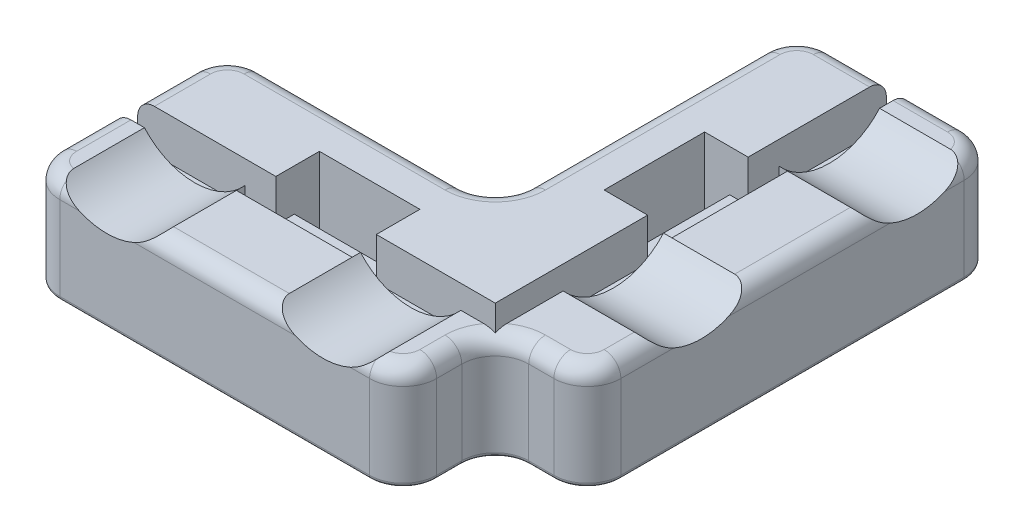
from build123d import *

# Parameters (mm, degrees)
EXTRUDE_677_DEPTH        = 12.5
SKETCH_6_R               = 1
CUT_EXTRUDE_1132_DEPTH   = 7
FILLET_1_R               = 2
CUT_EXTRUDE_1_DEPTH      = 84.019576005
CUT_EXTRUDE_1_DEPTH_BACK = 84.019576005
SKETCH_7_W               = 12
SKETCH_7_H               = 3
SKETCH_7_W_2             = 3
SKETCH_7_H_2             = 12
CUT_EXTRUDE_2_DEPTH      = 5
CUT_EXTRUDE_3_REACH      = 85.02
SKETCH_9_R               = 8
CUT_EXTRUDE_4_REACH      = 85.02
SKETCH_10_R              = 8
SKETCH_11_W              = 13.815009386
SKETCH_11_H              = 1
SKETCH_11_W_2            = 1
SKETCH_11_H_2            = 13.815009386
CUT_EXTRUDE_7_DEPTH      = 5
FILLET_2_R               = 0.5


with BuildPart() as part:
    # Эскиз1 → Extrude 677 (new body)
    with BuildSketch(Plane(origin=(0, 0, 0), x_dir=(1, 0, 0), z_dir=(0, 1, 0))):
        with BuildLine():
            Line((4, 0), (41, 0))
            ThreePointArc((41, 0), (43.828427125, 1.171572875), (45, 4))
            Line((45, 4), (45, 7))
            ThreePointArc((45, 7), (46.171572875, 9.828427125), (49, 11))
            Line((49, 11), (52, 11))
            ThreePointArc((52, 11), (54.828427125, 12.171572875), (56, 15))
            Line((56, 15), (56, 56))
            ThreePointArc((56, 56), (54.828427125, 58.828427125), (52, 60))
            Line((52, 60), (36, 60))
            ThreePointArc((36, 60), (33.171572875, 58.828427125), (32, 56))
            Line((32, 56), (32, 28))
            ThreePointArc((32, 28), (30.828427125, 25.171572875), (28, 24))
            Line((28, 24), (4, 24))
            ThreePointArc((4, 24), (1.171572875, 22.828427125), (0, 20))
            Line((0, 20), (0, 4))
            ThreePointArc((0, 4), (1.171572875, 1.171572875), (4, 0))
        make_face()
    extrude(amount=EXTRUDE_677_DEPTH)

    # Эскиз6 → Cut-Extrude 1132 (cut)
    with BuildSketch(Plane.XZ):
        with Locations(Location((4, -4, 0), (0, 0, 270))):
            Circle(SKETCH_6_R)
        with Locations(Location((41, -4, 0), (0, 0, 270))):
            Circle(SKETCH_6_R)
        with Locations(Location((52, -15, 0), (0, 0, 270))):
            Circle(SKETCH_6_R)
        with Locations(Location((4, -20, 0), (0, 0, 270))):
            Circle(SKETCH_6_R)
        with Locations(Location((36, -56, 0), (0, 0, 270))):
            Circle(SKETCH_6_R)
        with Locations(Location((52, -56, 0), (0, 0, 270))):
            Circle(SKETCH_6_R)
        with Locations(Location((34, -22, 0), (0, 0, 270))):
            Circle(SKETCH_6_R)
    extrude(amount=-CUT_EXTRUDE_1132_DEPTH, mode=Mode.SUBTRACT)

    # Скругление1
    fillet_1_edges = [part.edges().sort_by_distance(p)[0] for p in [
        (54.828427125, 12.5, -58.828427125),
        (44, 12.5, -60),
        (33.171572875, 12.5, -58.828427125),
        (32, 12.5, -42),
        (30.828427125, 12.5, -25.171572875),
        (16, 12.5, -24),
        (1.171572875, 12.5, -22.828427125),
        (0, 12.5, -12),
        (1.171572875, 12.5, -1.171572875),
        (22.5, 12.5, 0),
        (54.828427125, 12.5, -12.171572875),
        (43.828427125, 12.5, -1.171572875),
        (45, 12.5, -5.5),
        (46.171572875, 12.5, -9.828427125),
        (50.5, 12.5, -11),
        (56, 12.5, -35.5),
    ]]
    fillet(fillet_1_edges, radius=FILLET_1_R)

    # Эскиз7 → Вырез-Вытянуть1 (cut, two sides: drawn at the far end of the back side and taken through both)
    with BuildSketch(Plane(origin=(0, 12.5, 0), x_dir=(1, 0, 0), z_dir=(0, 1, 0)).offset(-CUT_EXTRUDE_1_DEPTH_BACK)):
        with Locations((22.5, 17)):
            Rectangle(SKETCH_7_W, SKETCH_7_H)
        with Locations((39, 37.5)):
            Rectangle(SKETCH_7_W_2, SKETCH_7_H_2)
    extrude(amount=CUT_EXTRUDE_1_DEPTH + CUT_EXTRUDE_1_DEPTH_BACK, mode=Mode.SUBTRACT)

    # Эскиз8 → Вырез-Вытянуть2 (cut)
    with BuildSketch(Plane(origin=(0, 12.5, 0), x_dir=(1, 0, 0), z_dir=(0, 1, 0))):
        Polygon((0, 13.3), (16.5, 13.3), (16.5, 15.5), (28.5, 15.5), (28.5, 13.3), (42.7, 13.3), (42.7, 31.5), (40.5, 31.5), (40.5, 43.5), (42.7, 43.5), (42.7, 61), (45.5, 61), (45.5, 10.5), (0, 10.5), align=None)
    extrude(amount=-CUT_EXTRUDE_2_DEPTH, mode=Mode.SUBTRACT)

    # Вырез-Вытянуть3: up to this face of the body (flat: up to its plane)
    cut_extrude_3_end = Plane(part.part.faces().sort_by_distance((8.332046161, 9.978411286, -13.3))[0])
    # Эскиз9 → Вырез-Вытянуть3 (cut, up to the picked face)
    with BuildSketch(Plane.XY, mode=Mode.PRIVATE) as cut_extrude_3_sk1:
        with Locations((9.6, 17.8)):
            Circle(SKETCH_9_R)
    cut_extrude_3_tool1 = split(extrude(cut_extrude_3_sk1.sketch, amount=-CUT_EXTRUDE_3_REACH, mode=Mode.PRIVATE), bisect_by=cut_extrude_3_end, keep=Keep.BOTH, mode=Mode.PRIVATE)
    # Эскиз9 → Вырез-Вытянуть3 (cut, up to the picked face)
    with BuildSketch(Plane.XY, mode=Mode.PRIVATE) as cut_extrude_3_sk2:
        with Locations((35.4, 17.8)):
            Circle(SKETCH_9_R)
    cut_extrude_3_tool2 = split(extrude(cut_extrude_3_sk2.sketch, amount=-CUT_EXTRUDE_3_REACH, mode=Mode.PRIVATE), bisect_by=cut_extrude_3_end, keep=Keep.BOTH, mode=Mode.PRIVATE)
    add(cut_extrude_3_tool1.solids().sort_by(Axis((9.6, 17.8, 0), (0, 0, -1)))[0], mode=Mode.SUBTRACT)
    add(cut_extrude_3_tool2.solids().sort_by(Axis((35.4, 17.8, 0), (0, 0, -1)))[0], mode=Mode.SUBTRACT)

    # Вырез-Вытянуть4: up to this face of the body (flat: up to its plane)
    cut_extrude_4_end = Plane(part.part.faces().sort_by_distance((42.7, 10, -22.4))[0])
    # Эскиз10 → Вырез-Вытянуть4 (cut, up to the picked face)
    with BuildSketch(Plane(origin=(56, 0, 0), x_dir=(0, 0, -1), z_dir=(1, 0, 0)), mode=Mode.PRIVATE) as cut_extrude_4_sk1:
        with Locations((24.6, 17.8)):
            Circle(SKETCH_10_R)
    cut_extrude_4_tool1 = split(extrude(cut_extrude_4_sk1.sketch, amount=-CUT_EXTRUDE_4_REACH, mode=Mode.PRIVATE), bisect_by=cut_extrude_4_end, keep=Keep.BOTH, mode=Mode.PRIVATE)
    # Эскиз10 → Вырез-Вытянуть4 (cut, up to the picked face)
    with BuildSketch(Plane(origin=(56, 0, 0), x_dir=(0, 0, -1), z_dir=(1, 0, 0)), mode=Mode.PRIVATE) as cut_extrude_4_sk2:
        with Locations((50.4, 17.8)):
            Circle(SKETCH_10_R)
    cut_extrude_4_tool2 = split(extrude(cut_extrude_4_sk2.sketch, amount=-CUT_EXTRUDE_4_REACH, mode=Mode.PRIVATE), bisect_by=cut_extrude_4_end, keep=Keep.BOTH, mode=Mode.PRIVATE)
    add(cut_extrude_4_tool1.solids().sort_by(Axis((56, 17.8, -24.6), (-1, 0, 0)))[0], mode=Mode.SUBTRACT)
    add(cut_extrude_4_tool2.solids().sort_by(Axis((56, 17.8, -50.4), (-1, 0, 0)))[0], mode=Mode.SUBTRACT)

    # Эскиз11 → Вырез-Вытянуть7 (cut)
    with BuildSketch(Plane(origin=(0, 12.5, 0), x_dir=(1, 0, 0), z_dir=(0, 1, 0))):
        with Locations((22.5, 10)):
            Rectangle(SKETCH_11_W, SKETCH_11_H)
        with Locations((46, 37.5)):
            Rectangle(SKETCH_11_W_2, SKETCH_11_H_2)
    extrude(amount=-CUT_EXTRUDE_7_DEPTH, mode=Mode.SUBTRACT)

    # Скругление2
    fillet_2_edges = [part.edges().sort_by_distance(p)[0] for p in [
        (16.5, 0, -17),
        (22.5, 0, -18.5),
        (28.5, 0, -17),
        (22.5, 0, -15.5),
        (37.5, 0, -37.5),
        (39, 0, -43.5),
        (40.5, 0, -37.5),
        (39, 0, -31.5),
        (50.5, 0, -11),
        (46.171572875, 0, -9.828427125),
        (45, 0, -5.5),
        (43.828427125, 0, -1.171572875),
        (22.5, 0, 0),
        (1.171572875, 0, -1.171572875),
        (0, 0, -12),
        (1.171572875, 0, -22.828427125),
        (16, 0, -24),
        (30.828427125, 0, -25.171572875),
        (32, 0, -42),
        (33.171572875, 0, -58.828427125),
        (44, 0, -60),
        (54.828427125, 0, -58.828427125),
        (56, 0, -35.5),
        (54.828427125, 0, -12.171572875),
        (41, 0, -3),
        (52, 0, -14),
        (4, 0, -19),
        (52, 0, -55),
        (34, 0, -21),
        (36, 0, -55),
        (4, 0, -3),
    ]]
    fillet(fillet_2_edges, radius=FILLET_2_R)


solid = part.part
